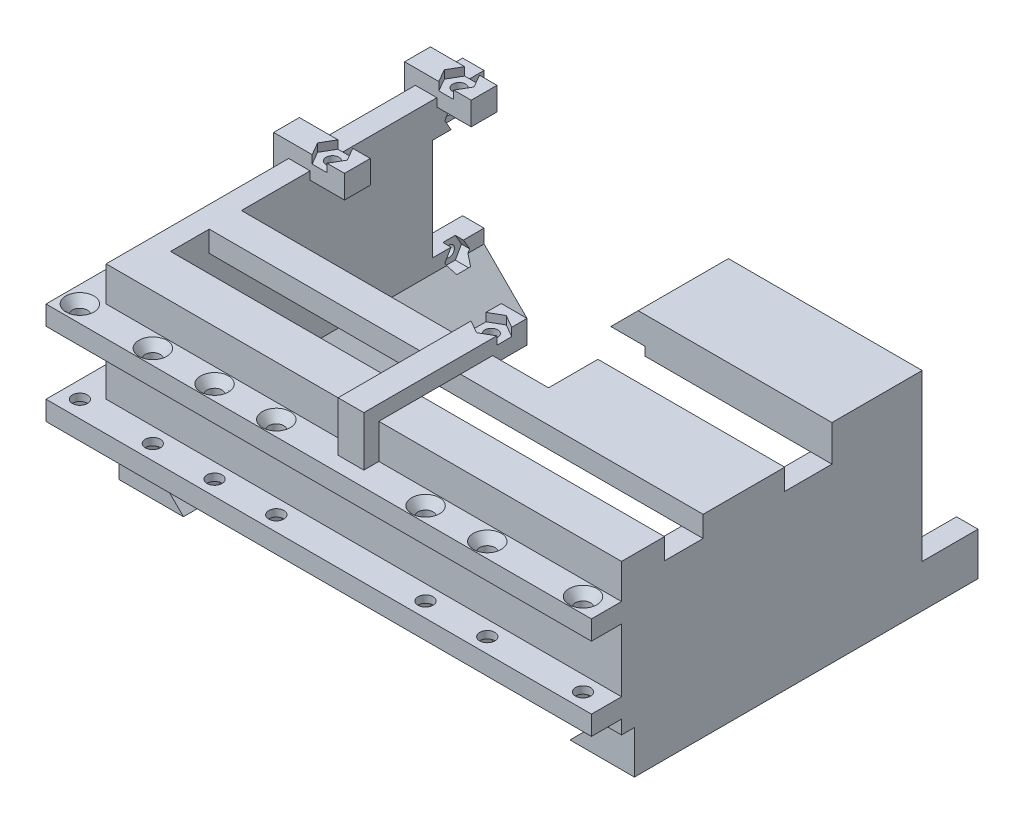
from build123d import *

# Parameters (mm, degrees)
SKETCH1_W                      = 120
SKETCH1_H                      = 90
BODY_DEPTH                     = 45
SLIDER_CUTS_DEPTH              = 118.153745139
SKETCH4_W                      = 120
SKETCH4_H                      = 10
LIMETS_DEPTH                   = 10
SKETCH5_W                      = 110
SKETCH5_H                      = 30.11321679
CHAMBER_DEPTH                  = 80
SKETCH7_W                      = 5
SKETCH7_H                      = 23.7
LEVER_CUTS_DEPTH               = 12
SKETCH8_R                      = 1.25
LEVER_SCREW_HOLE_A_DEPTH       = 8
LEVER_SCREW_HOLE_B_DEPTH       = 1.5
LEVER_SCREW_HOLE_B_DEPTH_BACK  = 1.9
SKETCH9_W                      = 68.5
SKETCH9_H                      = 4.88678321
UNO_BOARD_CUTS_DEPTH           = 56.5
CUT_EXTRUDE5_DEPTH             = 3
SKETCH17_W                     = 6
SKETCH17_H                     = 1.88678321
BOSS_EXTRUDE1_DEPTH            = 8
SKETCH20_W                     = 6
SKETCH20_H                     = 1.88678321
BOSS_EXTRUDE2_DEPTH            = 5
SKETCH21_W                     = 6
SKETCH21_H                     = 1.88678321
BOSS_EXTRUDE3_DEPTH            = 5
SKETCH23_W                     = 78
SKETCH23_H                     = 23.7
BUMPER_1_DEPTH                 = 7
SKETCH25_W                     = 13
SKETCH25_H                     = 6
SKETCH25_W_2                   = 6
SKETCH25_H_2                   = 38
BUMPER_2A_DEPTH                = 3.5
SKETCH26_W                     = 6
SKETCH26_H                     = 11.593391605
BUMPER_2B_DEPTH                = 3.5
SKETCH38_R                     = 1.5
BUMPER_2A_SH_A_DEPTH           = 5.38678321
BUMPER_2A_SH_B_DEPTH           = 1.9
SKETCH44_W                     = 6
SKETCH44_H                     = 6.5
BUMPER_3_DEPTH                 = 2.5
SKETCH28_W                     = 120
SKETCH28_H                     = 8.093391605
SKETCH28_H_2                   = 3.206608395
CUT_EXTRUDE6_DEPTH             = 7
SKETCH30_W                     = 43.5
SKETCH30_H                     = 13
CUT_EXTRUDE7_DEPTH             = 4.88678321
SKETCH31_W                     = 43.5
SKETCH31_H                     = 11
CUT_EXTRUDE8_DEPTH             = 4.88678321
SKETCH35_W                     = 115
SKETCH35_H                     = 9
CUT_EXTRUDE10_DEPTH            = 4.88678321
SKETCH40_W                     = 73.5
SKETCH40_H                     = 14.7
BUMPER_1_CUT_A_DEPTH           = 7
SKETCH41_W                     = 120
SKETCH41_H                     = 14.7
BUMPER_1_CUT_B_DEPTH           = 7
SKETCH29_W                     = 6
SKETCH29_H                     = 8.093391605
BUMPER_4_DEPTH                 = 3.5
SKETCH32_W                     = 43.5
SKETCH32_H                     = 21
BUMPER_5A_DEPTH                = 3.5
SKETCH33_W                     = 21
SKETCH33_H                     = 6.38678321
BUMPER_5B_DEPTH                = 8
BUMPER_5B_CUT_DEPTH            = 21
SKETCH47_W                     = 5
SKETCH47_H                     = 30.113284582
CUT_EXTRUDE15_DEPTH            = 13
CUT_EXTRUDE16_START            = -23.7
SKETCH52_R                     = 1.75
CUT_EXTRUDE16_DEPTH            = 23.7
CUT_EXTRUDE18_DEPTH            = 2.8
SKETCH55_R                     = 3.25
CUT_EXTRUDE19_DEPTH            = 2.1
CUT_EXTRUDE19_DRAFT            = -35.537677792
CUT_EXTRUDE19_PROFILE_2_DEPTH  = 2.1
CUT_EXTRUDE19_PROFILE_2_DRAFT  = -35.537677792
CUT_EXTRUDE19_PROFILE_3_DEPTH  = 2.1
CUT_EXTRUDE19_PROFILE_3_DRAFT  = -35.537677792
CUT_EXTRUDE19_PROFILE_4_DEPTH  = 2.1
CUT_EXTRUDE19_PROFILE_4_DRAFT  = -35.537677792
CUT_EXTRUDE19_PROFILE_5_DEPTH  = 2.1
CUT_EXTRUDE19_PROFILE_5_DRAFT  = -35.537677792
CUT_EXTRUDE19_PROFILE_6_DEPTH  = 2.1
CUT_EXTRUDE19_PROFILE_6_DRAFT  = -35.537677792
CUT_EXTRUDE19_PROFILE_7_DEPTH  = 2.1
CUT_EXTRUDE19_PROFILE_7_DRAFT  = -35.537677792
CUT_EXTRUDE19_PROFILE_8_DEPTH  = 2.1
CUT_EXTRUDE19_PROFILE_8_DRAFT  = -35.537677792
CUT_EXTRUDE19_PROFILE_9_DEPTH  = 2.1
CUT_EXTRUDE19_PROFILE_9_DRAFT  = -35.537677792
CUT_EXTRUDE19_PROFILE_10_DEPTH = 2.1
CUT_EXTRUDE19_PROFILE_10_DRAFT = -35.537677792


with BuildPart() as part:
    # Sketch1 → body (new body)
    with BuildSketch(Plane(origin=(0, 0, 0), x_dir=(1, 0, 0), z_dir=(0, 1, 0))):
        Rectangle(SKETCH1_W, SKETCH1_H)
    extrude(amount=BODY_DEPTH)

    # Sketch3 → slider cuts (cut, through all)
    with BuildSketch(Plane.XY.offset(45)):
        Polygon((-55, 10), (55, 10), (45, 0), (-45, 0), align=None)
    extrude(amount=-SLIDER_CUTS_DEPTH, mode=Mode.SUBTRACT)

    # Sketch4 → limets (cut)
    with BuildSketch(Plane.XY.offset(45)):
        with Locations((0, 5)):
            Rectangle(SKETCH4_W, SKETCH4_H)
    extrude(amount=-LIMETS_DEPTH, mode=Mode.SUBTRACT)

    # Sketch5 → chamber (cut)
    with BuildSketch(Plane(origin=(0, 0, -45), x_dir=(-1, 0, 0), z_dir=(0, 0, -1))):
        with Locations((0, 25.056608395)):
            Rectangle(SKETCH5_W, SKETCH5_H)
    extrude(amount=-CHAMBER_DEPTH, mode=Mode.SUBTRACT)

    # Sketch7 → lever cuts (cut)
    with BuildSketch(Plane(origin=(0, 0, -45), x_dir=(-1, 0, 0), z_dir=(0, 0, -1))):
        with Locations((57.5, 25.056608395)):
            Rectangle(SKETCH7_W, SKETCH7_H)
    extrude(amount=-LEVER_CUTS_DEPTH, mode=Mode.SUBTRACT)

    # Sketch8 → lever screw hole a (cut)
    with BuildSketch(Plane.ZY.offset(60)):
        with Locations((-38.75, 10.706608395)):
            Circle(SKETCH8_R)
        with Locations((-38.75, 39.406608395)):
            Circle(SKETCH8_R)
    extrude(amount=-LEVER_SCREW_HOLE_A_DEPTH, mode=Mode.SUBTRACT)

    # Sketch37 → lever screw hole b (cut, two sides: drawn at the far end of the back side and taken through both)
    with BuildSketch(Plane(origin=(-55, 0, 0), x_dir=(0, 0, -1), z_dir=(1, 0, 0)).offset(-LEVER_SCREW_HOLE_B_DEPTH_BACK)):
        Polygon((40.193375673, 36.906608395), (41.636751346, 39.406608395), (40.193375673, 41.906608395), (37.306624327, 41.906608395), (35.863248654, 39.406608395), (37.306624327, 36.906608395), align=None)
        Polygon((37.306624327, 13.206608395), (35.863248654, 10.706608395), (37.306624327, 8.206608395), (40.193375673, 8.206608395), (41.636751346, 10.706608395), (40.193375673, 13.206608395), align=None)
    extrude(amount=LEVER_SCREW_HOLE_B_DEPTH + LEVER_SCREW_HOLE_B_DEPTH_BACK, mode=Mode.SUBTRACT)

    # Sketch9 → uno board cuts (cut)
    with BuildSketch(Plane(origin=(0, 0, -45), x_dir=(-1, 0, 0), z_dir=(0, 0, -1))):
        with Locations((17.75, 42.556608395)):
            Rectangle(SKETCH9_W, SKETCH9_H)
    extrude(amount=-UNO_BOARD_CUTS_DEPTH, mode=Mode.SUBTRACT)

    # Sketch16 → Cut-Extrude5 (cut)
    with BuildSketch(Plane(origin=(-52, 0, 0), x_dir=(0, 0, -1), z_dir=(1, 0, 0))):
        Polygon((-11.5, 43.11321679), (-11.5, 45), (4.5, 45), (4.5, 43.11321679), (10.5, 43.11321679), (10.5, 45), (34, 45), (34, 43.11321679), (40, 43.11321679), (40, 45), (45, 45), (45, 43.11321679), (45, 40.11321679), (33, 40.11321679), (12.5, 40.11321679), (-11.5, 40.11321679), align=None)
    extrude(amount=-CUT_EXTRUDE5_DEPTH, mode=Mode.SUBTRACT)

    # Sketch17 → Boss-Extrude1 (add)
    with BuildSketch(Plane(origin=(0, 0, 11.5), x_dir=(-1, 0, 0), z_dir=(0, 0, -1))):
        with Locations((-0.5, 44.056608395)):
            Rectangle(SKETCH17_W, SKETCH17_H)
    extrude(amount=BOSS_EXTRUDE1_DEPTH)

    # Sketch20 → Boss-Extrude2 (add)
    with BuildSketch(Plane(origin=(-52, 0, 0), x_dir=(0, 0, -1), z_dir=(1, 0, 0))):
        with Locations((37, 44.056608395)):
            Rectangle(SKETCH20_W, SKETCH20_H)
    extrude(amount=BOSS_EXTRUDE2_DEPTH)

    # Sketch21 → Boss-Extrude3 (add)
    with BuildSketch(Plane(origin=(-52, 0, 0), x_dir=(0, 0, -1), z_dir=(1, 0, 0))):
        with Locations((7.5, 44.056608395)):
            Rectangle(SKETCH21_W, SKETCH21_H)
    extrude(amount=BOSS_EXTRUDE3_DEPTH)

    # Sketch23 → bumper 1 (add)
    with BuildSketch(Plane.ZY.offset(60)):
        with Locations((6, 25.056608395)):
            Rectangle(SKETCH23_W, SKETCH23_H)
    extrude(amount=BUMPER_1_DEPTH)

    # Sketch25 → bumper 2a (add)
    with BuildSketch(Plane(origin=(0, 45, 0), x_dir=(1, 0, 0), z_dir=(0, 1, 0))):
        with Locations((-53.5, 37)):
            Rectangle(SKETCH25_W, SKETCH25_H)
        with Locations((-53.5, 7.5)):
            Rectangle(SKETCH25_W, SKETCH25_H)
        with Locations((0.5, -22.5)):
            Rectangle(SKETCH25_W_2, SKETCH25_H_2)
    extrude(amount=BUMPER_2A_DEPTH)

    # Sketch26 → bumper 2b (add)
    with BuildSketch(Plane.ZY.offset(60)):
        with Locations((-7.5, 42.703304198)):
            Rectangle(SKETCH26_W, SKETCH26_H)
    extrude(amount=BUMPER_2B_DEPTH)

    # Sketch38 → bumper 2a SH a (cut)
    with BuildSketch(Plane.XZ.offset(-43.11321679)):
        with Locations(Location((-52.802091896, -7.5, 0), (0, 0, 270))):
            Circle(SKETCH38_R)
        with Locations(Location((-52.802091896, -37, 0), (0, 0, 270))):
            Circle(SKETCH38_R)
        with Locations(Location((0.5, 8.8, 0), (0, 0, 270))):
            Circle(SKETCH38_R)
    extrude(amount=-BUMPER_2A_SH_A_DEPTH, mode=Mode.SUBTRACT)

    # Sketch39 → bumper 2a SH b (cut)
    with BuildSketch(Plane(origin=(0, 48.5, 0), x_dir=(1, 0, 0), z_dir=(0, 1, 0))):
        Polygon((3.5, -10.532050808), (3.5, -7.067949192), (0.5, -5.335898385), (-2.5, -7.067949192), (-2.5, -10.532050808), (0.5, -12.264101615), align=None)
        Polygon((-51.070041089, 10.5), (-54.534142704, 10.5), (-56.266193512, 7.5), (-54.534142704, 4.5), (-51.070041089, 4.5), (-49.337990281, 7.5), align=None)
        Polygon((-51.070041089, 40), (-54.534142704, 40), (-56.266193512, 37), (-54.534142704, 34), (-51.070041089, 34), (-49.337990281, 37), align=None)
    extrude(amount=-BUMPER_2A_SH_B_DEPTH, mode=Mode.SUBTRACT)

    # Sketch44 → bumper 3 (add)
    with BuildSketch(Plane.ZY.offset(60)):
        with Locations((-37, 45.25)):
            Rectangle(SKETCH44_W, SKETCH44_H)
    extrude(amount=BUMPER_3_DEPTH)

    # Sketch28 → Cut-Extrude6 (cut)
    with BuildSketch(Plane.XY.offset(45)):
        with Locations((0, 40.953304198)):
            Rectangle(SKETCH28_W, SKETCH28_H)
        with Locations((0, 11.603304197)):
            Rectangle(SKETCH28_W, SKETCH28_H_2)
    extrude(amount=-CUT_EXTRUDE6_DEPTH, mode=Mode.SUBTRACT)

    # Sketch30 → Cut-Extrude7 (cut)
    with BuildSketch(Plane(origin=(0, 45, 0), x_dir=(1, 0, 0), z_dir=(0, 1, 0))):
        with Locations((38.25, 38.5)):
            Rectangle(SKETCH30_W, SKETCH30_H)
    extrude(amount=-CUT_EXTRUDE7_DEPTH, mode=Mode.SUBTRACT)

    # Sketch31 → Cut-Extrude8 (cut)
    with BuildSketch(Plane(origin=(0, 45, 0), x_dir=(1, 0, 0), z_dir=(0, 1, 0))):
        with Locations((38.25, 5.5)):
            Rectangle(SKETCH31_W, SKETCH31_H)
    extrude(amount=-CUT_EXTRUDE8_DEPTH, mode=Mode.SUBTRACT)

    # Sketch35 → Cut-Extrude10 (cut)
    with BuildSketch(Plane(origin=(0, 45, 0), x_dir=(1, 0, 0), z_dir=(0, 1, 0))):
        with Locations((2.5, -23.5)):
            Rectangle(SKETCH35_W, SKETCH35_H)
    extrude(amount=-CUT_EXTRUDE10_DEPTH, mode=Mode.SUBTRACT)

    # Sketch40 → bumper 1 CUT a (cut)
    with BuildSketch(Plane.ZY.offset(67)):
        with Locations((8.25, 25.056608395)):
            Rectangle(SKETCH40_W, SKETCH40_H)
    extrude(amount=-BUMPER_1_CUT_A_DEPTH, mode=Mode.SUBTRACT)

    # Sketch41 → bumper 1 CUT b (cut)
    with BuildSketch(Plane.XY.offset(45)):
        with Locations((0, 25.056608395)):
            Rectangle(SKETCH41_W, SKETCH41_H)
    extrude(amount=-BUMPER_1_CUT_B_DEPTH, mode=Mode.SUBTRACT)

    # Sketch29 → bumper 4 (add)
    with BuildSketch(Plane.XY.offset(38)):
        with Locations((0.5, 40.953304198)):
            Rectangle(SKETCH29_W, SKETCH29_H)
    extrude(amount=BUMPER_4_DEPTH)

    # Sketch32 → bumper 5a (add)
    with BuildSketch(Plane(origin=(0, 45, 0), x_dir=(1, 0, 0), z_dir=(0, 1, 0))):
        with Locations((38.25, 21.5)):
            Rectangle(SKETCH32_W, SKETCH32_H)
    extrude(amount=BUMPER_5A_DEPTH)

    # Sketch33 → bumper 5b (add)
    with BuildSketch(Plane.ZY.offset(-16.5)):
        with Locations((-21.5, 45.306608395)):
            Rectangle(SKETCH33_W, SKETCH33_H)
    extrude(amount=BUMPER_5B_DEPTH)

    # Sketch34 → bumper 5b cut (cut)
    with BuildSketch(Plane(origin=(0, 0, -32), x_dir=(-1, 0, 0), z_dir=(0, 0, -1))):
        Polygon((-8.5, 42.11321679), (-8.5, 48.5), (-14.88678321, 48.5), align=None)
    extrude(amount=-BUMPER_5B_CUT_DEPTH, mode=Mode.SUBTRACT)

    # Sketch47 → Cut-Extrude15 (cut)
    with BuildSketch(Plane(origin=(0, 0, -45), x_dir=(-1, 0, 0), z_dir=(0, 0, -1))):
        with Locations((-57.5, 25.056574499)):
            Rectangle(SKETCH47_W, SKETCH47_H)
    extrude(amount=-CUT_EXTRUDE15_DEPTH, mode=Mode.SUBTRACT)

    # Sketch52 → Cut-Extrude16 (cut)
    with BuildSketch(Plane(origin=(0, 36.906608395, 0), x_dir=(1, 0, 0), z_dir=(0, 1, 0)).offset(CUT_EXTRUDE16_START)):
        with Locations(Location((-63.5, 21.75, 0), (0, 0, 270))):
            Circle(SKETCH52_R)
        with Locations(Location((-63.5, -9.666666667, 0), (0, 0, 270))):
            Circle(SKETCH52_R)
        with Locations(Location((-63.5, -23.833333333, 0), (0, 0, 270))):
            Circle(SKETCH52_R)
        with Locations(Location((-45.625, -41.5, 0), (0, 0, 270))):
            Circle(SKETCH52_R)
        with Locations(Location((-31.25, -41.5, 0), (0, 0, 270))):
            Circle(SKETCH52_R)
        with Locations(Location((-16.875, -41.5, 0), (0, 0, 270))):
            Circle(SKETCH52_R)
        with Locations(Location((17.875, -41.5, 0), (0, 0, 270))):
            Circle(SKETCH52_R)
        with Locations(Location((32.25, -41.5, 0), (0, 0, 270))):
            Circle(SKETCH52_R)
        with Locations(Location((-63.055165377, -41.055165377, 0), (0, 0, 270))):
            Circle(SKETCH52_R)
        with Locations(Location((54.535898385, -41.5, 0), (0, 0, 270))):
            Circle(SKETCH52_R)
    extrude(amount=CUT_EXTRUDE16_DEPTH, mode=Mode.SUBTRACT)

    # Sketch54 → Cut-Extrude18 (cut)
    with BuildSketch(Plane.XZ.offset(-13.206608395)):
        Polygon((-63.5, -25.214101615), (-60.5, -23.482050808), (-60.5, -20.017949192), (-63.5, -18.285898385), (-66.5, -20.017949192), (-66.5, -23.482050808), align=None)
        Polygon((-63.5, 6.202565052), (-60.5, 7.934615859), (-60.5, 11.398717474), (-63.5, 13.130768282), (-66.5, 11.398717474), (-66.5, 7.934615859), align=None)
        Polygon((-42.160898385, 41.5), (-43.892949192, 44.5), (-47.357050808, 44.5), (-49.089101615, 41.5), (-47.357050808, 38.5), (-43.892949192, 38.5), align=None)
        Polygon((-27.785898385, 41.5), (-29.517949192, 44.5), (-32.982050808, 44.5), (-34.714101615, 41.5), (-32.982050808, 38.5), (-29.517949192, 38.5), align=None)
        Polygon((-13.410898385, 41.5), (-15.142949192, 44.5), (-18.607050808, 44.5), (-20.339101615, 41.5), (-18.607050808, 38.5), (-15.142949192, 38.5), align=None)
        Polygon((21.339101615, 41.5), (19.607050808, 44.5), (16.142949192, 44.5), (14.410898385, 41.5), (16.142949192, 38.5), (19.607050808, 38.5), align=None)
        Polygon((35.714101615, 41.5), (33.982050808, 44.5), (30.517949192, 44.5), (28.785898385, 41.5), (30.517949192, 38.5), (33.982050808, 38.5), align=None)
        Polygon((-60.596337998, 38.596337998), (-59.696344714, 41.955158661), (-62.155172093, 44.413986041), (-65.513992756, 43.513992756), (-66.413986041, 40.155172093), (-63.955158661, 37.696344714), align=None)
        Polygon((51.071924582, 41.529757261), (52.778140939, 38.51498932), (56.242114742, 38.485232058), (57.999872188, 41.470242739), (56.29365583, 44.48501068), (52.829682028, 44.514767942), align=None)
        Polygon((-63.5, 20.369231718), (-60.5, 22.101282526), (-60.5, 25.565384141), (-63.5, 27.297434948), (-66.5, 25.565384141), (-66.5, 22.101282526), align=None)
    extrude(amount=-CUT_EXTRUDE18_DEPTH, mode=Mode.SUBTRACT)


with BuildPart() as cut_extrude19_tool:
    # Sketch55 → Cut-Extrude19 (with draft: the straight prism first)
    with BuildSketch(Plane(origin=(0, 36.906608395, 0), x_dir=(1, 0, 0), z_dir=(0, 1, 0))):
        with Locations((-63.5, 21.75)):
            Circle(SKETCH55_R)
    extrude(amount=-CUT_EXTRUDE19_DEPTH)
    # Cut-Extrude19: the draft: its side faces are tilted about the plane it starts from
    cut_extrude19_sides = [cut_extrude19_tool.faces().sort_by_distance(p)[0] for p in [
        (-66.75, 35.856608395, -21.75),
    ]]
    draft(cut_extrude19_sides, Plane(origin=(0, 36.906608395, 0), x_dir=(1, 0, 0), z_dir=(0, 1, 0)), CUT_EXTRUDE19_DRAFT)


with BuildPart() as part_1:
    add(part.part)

    # Cut-Extrude19: cut by cut_extrude19_tool
    add(cut_extrude19_tool.part, mode=Mode.SUBTRACT)


with BuildPart() as cut_extrude19_profile_2_tool:
    # Sketch55 → Cut-Extrude19 profile 2 (with draft: the straight prism first)
    with BuildSketch(Plane(origin=(0, 36.906608395, 0), x_dir=(1, 0, 0), z_dir=(0, 1, 0))):
        with Locations((-63.5, -9.666666667)):
            Circle(SKETCH55_R)
    extrude(amount=-CUT_EXTRUDE19_PROFILE_2_DEPTH)
    # Cut-Extrude19 profile 2: the draft: its side faces are tilted about the plane it starts from
    cut_extrude19_profile_2_sides = [cut_extrude19_profile_2_tool.faces().sort_by_distance(p)[0] for p in [
        (-66.75, 35.856608395, 9.666666667),
    ]]
    draft(cut_extrude19_profile_2_sides, Plane(origin=(0, 36.906608395, 0), x_dir=(1, 0, 0), z_dir=(0, 1, 0)), CUT_EXTRUDE19_PROFILE_2_DRAFT)


with BuildPart() as part_2:
    add(part_1.part)

    # Cut-Extrude19 profile 2: cut by cut_extrude19_profile_2_tool
    add(cut_extrude19_profile_2_tool.part, mode=Mode.SUBTRACT)


with BuildPart() as cut_extrude19_profile_3_tool:
    # Sketch55 → Cut-Extrude19 profile 3 (with draft: the straight prism first)
    with BuildSketch(Plane(origin=(0, 36.906608395, 0), x_dir=(1, 0, 0), z_dir=(0, 1, 0))):
        with Locations((-63.5, -23.833333333)):
            Circle(SKETCH55_R)
    extrude(amount=-CUT_EXTRUDE19_PROFILE_3_DEPTH)
    # Cut-Extrude19 profile 3: the draft: its side faces are tilted about the plane it starts from
    cut_extrude19_profile_3_sides = [cut_extrude19_profile_3_tool.faces().sort_by_distance(p)[0] for p in [
        (-66.75, 35.856608395, 23.833333333),
    ]]
    draft(cut_extrude19_profile_3_sides, Plane(origin=(0, 36.906608395, 0), x_dir=(1, 0, 0), z_dir=(0, 1, 0)), CUT_EXTRUDE19_PROFILE_3_DRAFT)


with BuildPart() as part_3:
    add(part_2.part)

    # Cut-Extrude19 profile 3: cut by cut_extrude19_profile_3_tool
    add(cut_extrude19_profile_3_tool.part, mode=Mode.SUBTRACT)


with BuildPart() as cut_extrude19_profile_4_tool:
    # Sketch55 → Cut-Extrude19 profile 4 (with draft: the straight prism first)
    with BuildSketch(Plane(origin=(0, 36.906608395, 0), x_dir=(1, 0, 0), z_dir=(0, 1, 0))):
        with Locations((-63.055165377, -41.055165377)):
            Circle(SKETCH55_R)
    extrude(amount=-CUT_EXTRUDE19_PROFILE_4_DEPTH)
    # Cut-Extrude19 profile 4: the draft: its side faces are tilted about the plane it starts from
    cut_extrude19_profile_4_sides = [cut_extrude19_profile_4_tool.faces().sort_by_distance(p)[0] for p in [
        (-66.305165377, 35.856608395, 41.055165377),
    ]]
    draft(cut_extrude19_profile_4_sides, Plane(origin=(0, 36.906608395, 0), x_dir=(1, 0, 0), z_dir=(0, 1, 0)), CUT_EXTRUDE19_PROFILE_4_DRAFT)


with BuildPart() as part_4:
    add(part_3.part)

    # Cut-Extrude19 profile 4: cut by cut_extrude19_profile_4_tool
    add(cut_extrude19_profile_4_tool.part, mode=Mode.SUBTRACT)


with BuildPart() as cut_extrude19_profile_5_tool:
    # Sketch55 → Cut-Extrude19 profile 5 (with draft: the straight prism first)
    with BuildSketch(Plane(origin=(0, 36.906608395, 0), x_dir=(1, 0, 0), z_dir=(0, 1, 0))):
        with Locations((-45.625, -41.5)):
            Circle(SKETCH55_R)
    extrude(amount=-CUT_EXTRUDE19_PROFILE_5_DEPTH)
    # Cut-Extrude19 profile 5: the draft: its side faces are tilted about the plane it starts from
    cut_extrude19_profile_5_sides = [cut_extrude19_profile_5_tool.faces().sort_by_distance(p)[0] for p in [
        (-48.875, 35.856608395, 41.5),
    ]]
    draft(cut_extrude19_profile_5_sides, Plane(origin=(0, 36.906608395, 0), x_dir=(1, 0, 0), z_dir=(0, 1, 0)), CUT_EXTRUDE19_PROFILE_5_DRAFT)


with BuildPart() as part_5:
    add(part_4.part)

    # Cut-Extrude19 profile 5: cut by cut_extrude19_profile_5_tool
    add(cut_extrude19_profile_5_tool.part, mode=Mode.SUBTRACT)


with BuildPart() as cut_extrude19_profile_6_tool:
    # Sketch55 → Cut-Extrude19 profile 6 (with draft: the straight prism first)
    with BuildSketch(Plane(origin=(0, 36.906608395, 0), x_dir=(1, 0, 0), z_dir=(0, 1, 0))):
        with Locations((-31.25, -41.5)):
            Circle(SKETCH55_R)
    extrude(amount=-CUT_EXTRUDE19_PROFILE_6_DEPTH)
    # Cut-Extrude19 profile 6: the draft: its side faces are tilted about the plane it starts from
    cut_extrude19_profile_6_sides = [cut_extrude19_profile_6_tool.faces().sort_by_distance(p)[0] for p in [
        (-34.5, 35.856608395, 41.5),
    ]]
    draft(cut_extrude19_profile_6_sides, Plane(origin=(0, 36.906608395, 0), x_dir=(1, 0, 0), z_dir=(0, 1, 0)), CUT_EXTRUDE19_PROFILE_6_DRAFT)


with BuildPart() as part_6:
    add(part_5.part)

    # Cut-Extrude19 profile 6: cut by cut_extrude19_profile_6_tool
    add(cut_extrude19_profile_6_tool.part, mode=Mode.SUBTRACT)


with BuildPart() as cut_extrude19_profile_7_tool:
    # Sketch55 → Cut-Extrude19 profile 7 (with draft: the straight prism first)
    with BuildSketch(Plane(origin=(0, 36.906608395, 0), x_dir=(1, 0, 0), z_dir=(0, 1, 0))):
        with Locations((-16.875, -41.5)):
            Circle(SKETCH55_R)
    extrude(amount=-CUT_EXTRUDE19_PROFILE_7_DEPTH)
    # Cut-Extrude19 profile 7: the draft: its side faces are tilted about the plane it starts from
    cut_extrude19_profile_7_sides = [cut_extrude19_profile_7_tool.faces().sort_by_distance(p)[0] for p in [
        (-20.125, 35.856608395, 41.5),
    ]]
    draft(cut_extrude19_profile_7_sides, Plane(origin=(0, 36.906608395, 0), x_dir=(1, 0, 0), z_dir=(0, 1, 0)), CUT_EXTRUDE19_PROFILE_7_DRAFT)


with BuildPart() as part_7:
    add(part_6.part)

    # Cut-Extrude19 profile 7: cut by cut_extrude19_profile_7_tool
    add(cut_extrude19_profile_7_tool.part, mode=Mode.SUBTRACT)


with BuildPart() as cut_extrude19_profile_8_tool:
    # Sketch55 → Cut-Extrude19 profile 8 (with draft: the straight prism first)
    with BuildSketch(Plane(origin=(0, 36.906608395, 0), x_dir=(1, 0, 0), z_dir=(0, 1, 0))):
        with Locations((17.875, -41.5)):
            Circle(SKETCH55_R)
    extrude(amount=-CUT_EXTRUDE19_PROFILE_8_DEPTH)
    # Cut-Extrude19 profile 8: the draft: its side faces are tilted about the plane it starts from
    cut_extrude19_profile_8_sides = [cut_extrude19_profile_8_tool.faces().sort_by_distance(p)[0] for p in [
        (14.625, 35.856608395, 41.5),
    ]]
    draft(cut_extrude19_profile_8_sides, Plane(origin=(0, 36.906608395, 0), x_dir=(1, 0, 0), z_dir=(0, 1, 0)), CUT_EXTRUDE19_PROFILE_8_DRAFT)


with BuildPart() as part_8:
    add(part_7.part)

    # Cut-Extrude19 profile 8: cut by cut_extrude19_profile_8_tool
    add(cut_extrude19_profile_8_tool.part, mode=Mode.SUBTRACT)


with BuildPart() as cut_extrude19_profile_9_tool:
    # Sketch55 → Cut-Extrude19 profile 9 (with draft: the straight prism first)
    with BuildSketch(Plane(origin=(0, 36.906608395, 0), x_dir=(1, 0, 0), z_dir=(0, 1, 0))):
        with Locations((32.25, -41.5)):
            Circle(SKETCH55_R)
    extrude(amount=-CUT_EXTRUDE19_PROFILE_9_DEPTH)
    # Cut-Extrude19 profile 9: the draft: its side faces are tilted about the plane it starts from
    cut_extrude19_profile_9_sides = [cut_extrude19_profile_9_tool.faces().sort_by_distance(p)[0] for p in [
        (29, 35.856608395, 41.5),
    ]]
    draft(cut_extrude19_profile_9_sides, Plane(origin=(0, 36.906608395, 0), x_dir=(1, 0, 0), z_dir=(0, 1, 0)), CUT_EXTRUDE19_PROFILE_9_DRAFT)


with BuildPart() as part_9:
    add(part_8.part)

    # Cut-Extrude19 profile 9: cut by cut_extrude19_profile_9_tool
    add(cut_extrude19_profile_9_tool.part, mode=Mode.SUBTRACT)


with BuildPart() as cut_extrude19_profile_10_tool:
    # Sketch55 → Cut-Extrude19 profile 10 (with draft: the straight prism first)
    with BuildSketch(Plane(origin=(0, 36.906608395, 0), x_dir=(1, 0, 0), z_dir=(0, 1, 0))):
        with Locations((54.535898385, -41.5)):
            Circle(SKETCH55_R)
    extrude(amount=-CUT_EXTRUDE19_PROFILE_10_DEPTH)
    # Cut-Extrude19 profile 10: the draft: its side faces are tilted about the plane it starts from
    cut_extrude19_profile_10_sides = [cut_extrude19_profile_10_tool.faces().sort_by_distance(p)[0] for p in [
        (51.285898385, 35.856608395, 41.5),
    ]]
    draft(cut_extrude19_profile_10_sides, Plane(origin=(0, 36.906608395, 0), x_dir=(1, 0, 0), z_dir=(0, 1, 0)), CUT_EXTRUDE19_PROFILE_10_DRAFT)


with BuildPart() as part_10:
    add(part_9.part)

    # Cut-Extrude19 profile 10: cut by cut_extrude19_profile_10_tool
    add(cut_extrude19_profile_10_tool.part, mode=Mode.SUBTRACT)


solid = part_10.part
